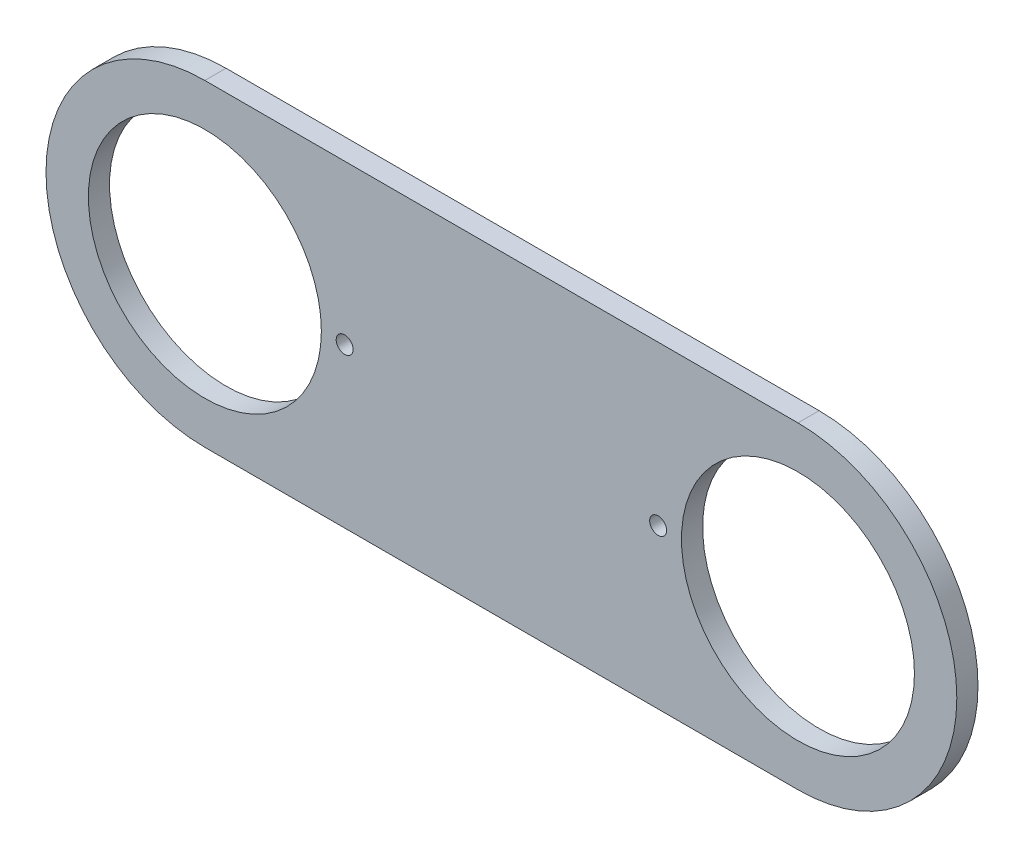
from build123d import *

# Parameters (mm, degrees)
SKETCH_1_R      = 27.5
SKETCH_1_R_2    = 2
EXTRUDE_1_DEPTH = 5


with BuildPart() as part:
    # 草图1 → 凸台-拉伸1 (new body)
    with BuildSketch(Plane.XY):
        with BuildLine():
            Line((0, 37.5), (140, 37.5))
            ThreePointArc((140, 37.5), (177.5, 0), (140, -37.5))
            Line((140, -37.5), (0, -37.5))
            ThreePointArc((0, -37.5), (-37.5, 0), (0, 37.5))
        make_face()
        Circle(SKETCH_1_R, mode=Mode.SUBTRACT)
        with Locations((140, 0)):
            Circle(SKETCH_1_R, mode=Mode.SUBTRACT)
        with Locations((33, 0)):
            Circle(SKETCH_1_R_2, mode=Mode.SUBTRACT)
        with Locations((107, 0)):
            Circle(SKETCH_1_R_2, mode=Mode.SUBTRACT)
    extrude(amount=EXTRUDE_1_DEPTH)


solid = part.part
